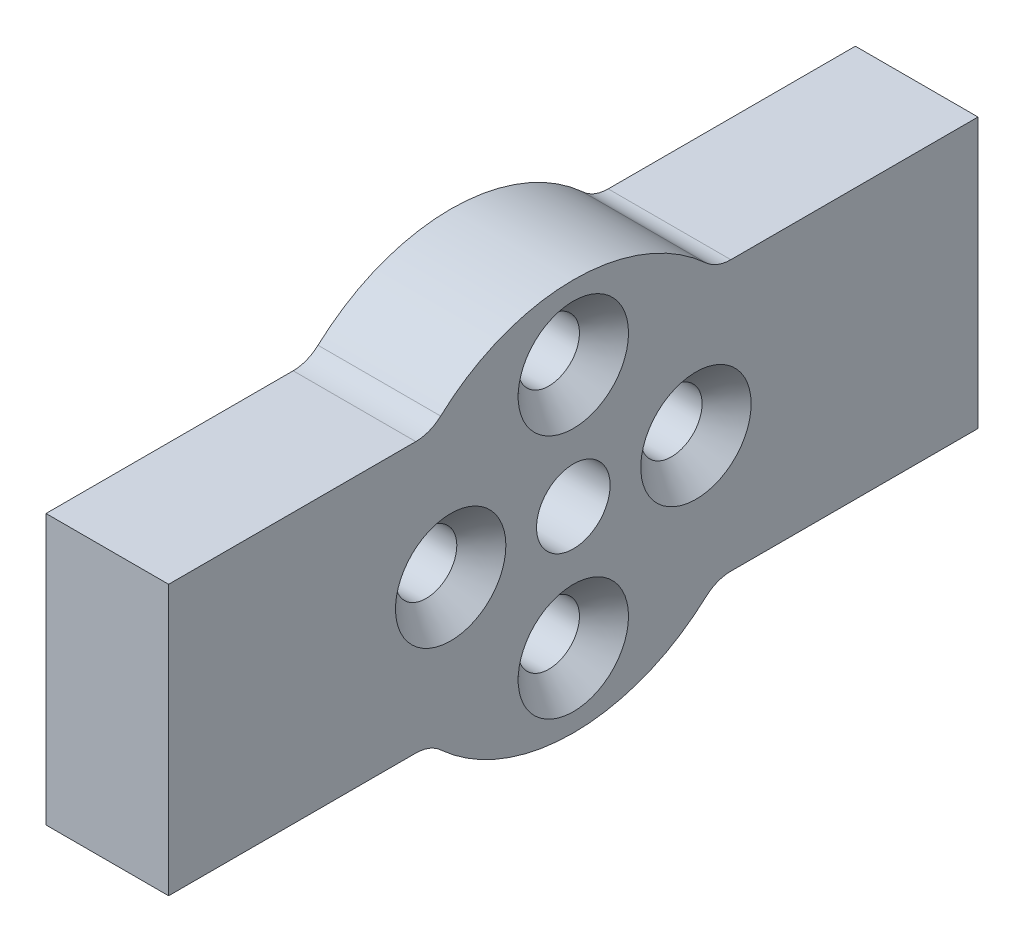
from build123d import *

# Parameters (mm, degrees)
EXTRUDE_1_DEPTH               = 10
SKETCH_2_R                    = 2.5
CUT_EXTRUDE_2_DEPTH           = 39.013155617
SKETCH_4_R                    = 4.5
CUT_EXTRUDE_3_DEPTH           = 2
CUT_EXTRUDE_3_DRAFT           = -45
CUT_EXTRUDE_3_PROFILE_2_DEPTH = 2
CUT_EXTRUDE_3_PROFILE_2_DRAFT = -45
CUT_EXTRUDE_3_PROFILE_3_DEPTH = 2
CUT_EXTRUDE_3_PROFILE_3_DRAFT = -45
CUT_EXTRUDE_3_PROFILE_4_DEPTH = 2
CUT_EXTRUDE_3_PROFILE_4_DRAFT = -45
SKETCH_5_R                    = 3
CUT_EXTRUDE_4_DEPTH           = 39.013155617


with BuildPart() as part:
    # Эскиз1 → Вытянуть1 (new body)
    with BuildSketch(Plane(origin=(0, 0, 0), x_dir=(0, 0, -1), z_dir=(1, 0, 0))):
        with BuildLine():
            Line((12.845232579, 11), (33, 11))
            Line((33, 11), (33, -11))
            Line((33, -11), (12.845232579, -11))
            ThreePointArc((12.845232579, -11), (11.757018204, -11.204326651), (10.817037961, -11.789473684))
            ThreePointArc((10.817037961, -11.789473684), (0, -16), (-10.817037961, -11.789473684))
            ThreePointArc((-10.817037961, -11.789473684), (-11.757018204, -11.204326651), (-12.845232579, -11))
            Line((-12.845232579, -11), (-33, -11))
            Line((-33, -11), (-33, 11))
            Line((-33, 11), (-12.845232579, 11))
            ThreePointArc((-12.845232579, 11), (-11.757018204, 11.204326651), (-10.817037961, 11.789473684))
            ThreePointArc((-10.817037961, 11.789473684), (0, 16), (10.817037961, 11.789473684))
            ThreePointArc((10.817037961, 11.789473684), (11.757018204, 11.204326651), (12.845232579, 11))
        make_face()
    extrude(amount=EXTRUDE_1_DEPTH)

    # Эскиз2 → Вытянуть2 (cut, through all)
    with BuildSketch(Plane(origin=(10, 0, 0), x_dir=(0, 0, -1), z_dir=(1, 0, 0))):
        with Locations((0, 10)):
            Circle(SKETCH_2_R)
        with Locations((10, 0)):
            Circle(SKETCH_2_R)
        with Locations((0, -10)):
            Circle(SKETCH_2_R)
        with Locations((-10, 0)):
            Circle(SKETCH_2_R)
    extrude(amount=-CUT_EXTRUDE_2_DEPTH, mode=Mode.SUBTRACT)


with BuildPart() as cut_extrude_3_tool:
    # Эскиз4 → Вытянуть3 (with draft: the straight prism first)
    with BuildSketch(Plane(origin=(10, 0, 0), x_dir=(0, 0, -1), z_dir=(1, 0, 0))):
        with Locations((0, 10)):
            Circle(SKETCH_4_R)
    extrude(amount=-CUT_EXTRUDE_3_DEPTH)
    # Вытянуть3: the draft: its side faces are tilted about the plane it starts from
    cut_extrude_3_sides = [cut_extrude_3_tool.faces().sort_by_distance(p)[0] for p in [
        (9, 10, 4.5),
    ]]
    draft(cut_extrude_3_sides, Plane(origin=(10, 0, 0), x_dir=(0, 0, -1), z_dir=(1, 0, 0)), CUT_EXTRUDE_3_DRAFT)


with BuildPart() as part_1:
    add(part.part)

    # Вытянуть3: cut by cut_extrude_3_tool
    add(cut_extrude_3_tool.part, mode=Mode.SUBTRACT)


with BuildPart() as cut_extrude_3_profile_2_tool:
    # Эскиз4 → Вытянуть3 profile 2 (with draft: the straight prism first)
    with BuildSketch(Plane(origin=(10, 0, 0), x_dir=(0, 0, -1), z_dir=(1, 0, 0))):
        with Locations((10, 0)):
            Circle(SKETCH_4_R)
    extrude(amount=-CUT_EXTRUDE_3_PROFILE_2_DEPTH)
    # Вытянуть3 profile 2: the draft: its side faces are tilted about the plane it starts from
    cut_extrude_3_profile_2_sides = [cut_extrude_3_profile_2_tool.faces().sort_by_distance(p)[0] for p in [
        (9, 0, -5.5),
    ]]
    draft(cut_extrude_3_profile_2_sides, Plane(origin=(10, 0, 0), x_dir=(0, 0, -1), z_dir=(1, 0, 0)), CUT_EXTRUDE_3_PROFILE_2_DRAFT)


with BuildPart() as part_2:
    add(part_1.part)

    # Вытянуть3 profile 2: cut by cut_extrude_3_profile_2_tool
    add(cut_extrude_3_profile_2_tool.part, mode=Mode.SUBTRACT)


with BuildPart() as cut_extrude_3_profile_3_tool:
    # Эскиз4 → Вытянуть3 profile 3 (with draft: the straight prism first)
    with BuildSketch(Plane(origin=(10, 0, 0), x_dir=(0, 0, -1), z_dir=(1, 0, 0))):
        with Locations((0, -10)):
            Circle(SKETCH_4_R)
    extrude(amount=-CUT_EXTRUDE_3_PROFILE_3_DEPTH)
    # Вытянуть3 profile 3: the draft: its side faces are tilted about the plane it starts from
    cut_extrude_3_profile_3_sides = [cut_extrude_3_profile_3_tool.faces().sort_by_distance(p)[0] for p in [
        (9, -10, 4.5),
    ]]
    draft(cut_extrude_3_profile_3_sides, Plane(origin=(10, 0, 0), x_dir=(0, 0, -1), z_dir=(1, 0, 0)), CUT_EXTRUDE_3_PROFILE_3_DRAFT)


with BuildPart() as part_3:
    add(part_2.part)

    # Вытянуть3 profile 3: cut by cut_extrude_3_profile_3_tool
    add(cut_extrude_3_profile_3_tool.part, mode=Mode.SUBTRACT)


with BuildPart() as cut_extrude_3_profile_4_tool:
    # Эскиз4 → Вытянуть3 profile 4 (with draft: the straight prism first)
    with BuildSketch(Plane(origin=(10, 0, 0), x_dir=(0, 0, -1), z_dir=(1, 0, 0))):
        with Locations((-10, 0)):
            Circle(SKETCH_4_R)
    extrude(amount=-CUT_EXTRUDE_3_PROFILE_4_DEPTH)
    # Вытянуть3 profile 4: the draft: its side faces are tilted about the plane it starts from
    cut_extrude_3_profile_4_sides = [cut_extrude_3_profile_4_tool.faces().sort_by_distance(p)[0] for p in [
        (9, 0, 14.5),
    ]]
    draft(cut_extrude_3_profile_4_sides, Plane(origin=(10, 0, 0), x_dir=(0, 0, -1), z_dir=(1, 0, 0)), CUT_EXTRUDE_3_PROFILE_4_DRAFT)


with BuildPart() as part_4:
    add(part_3.part)

    # Вытянуть3 profile 4: cut by cut_extrude_3_profile_4_tool
    add(cut_extrude_3_profile_4_tool.part, mode=Mode.SUBTRACT)

    # Эскиз5 → Вытянуть4 (cut, through all)
    with BuildSketch(Plane(origin=(10, 0, 0), x_dir=(0, 0, -1), z_dir=(1, 0, 0))):
        Circle(SKETCH_5_R)
    extrude(amount=-CUT_EXTRUDE_4_DEPTH, mode=Mode.SUBTRACT)


solid = part_4.part
